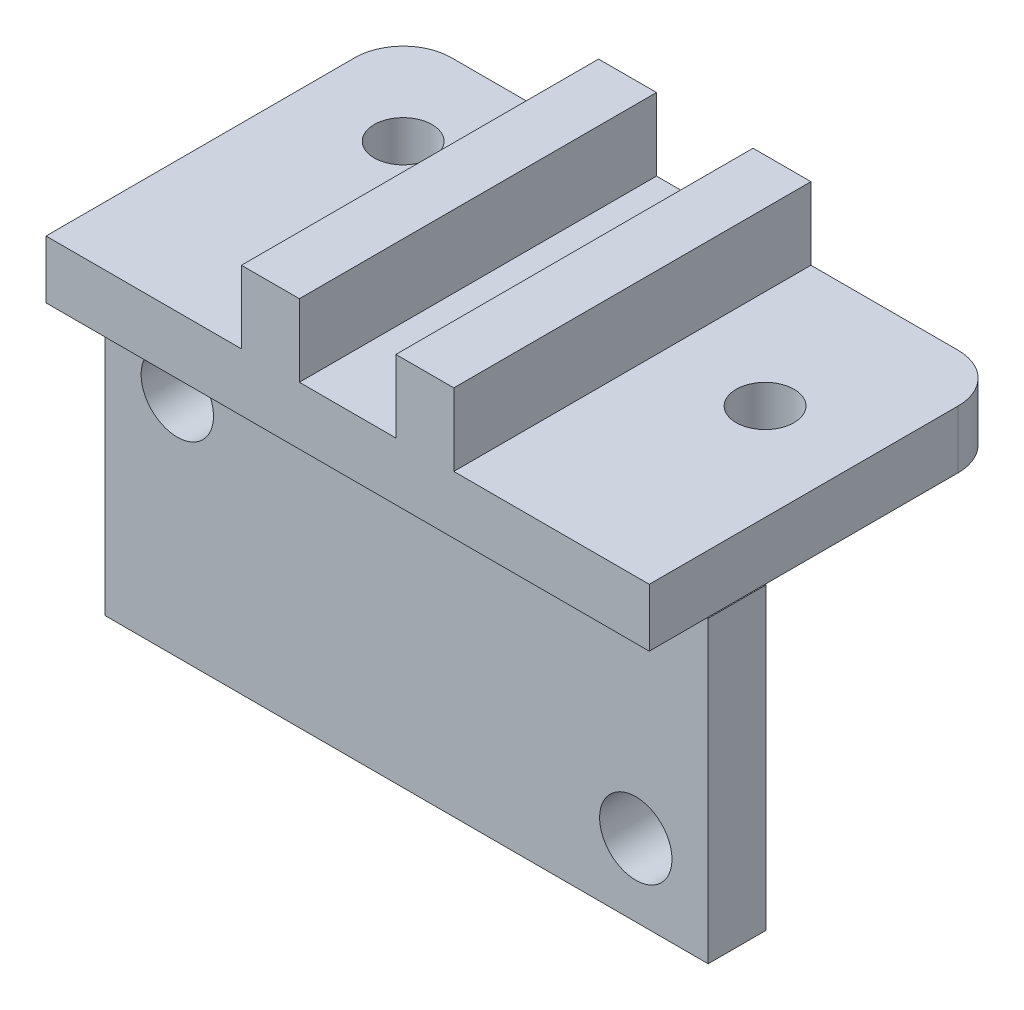
from build123d import *

# Parameters (mm, degrees)
SKETCH1_W           = 125
SKETCH1_H           = 62
BOSS_EXTRUDE1_DEPTH = 12
BOSS_EXTRUDE5_DEPTH = 12
SKETCH6_R           = 7.5
CUT_EXTRUDE2_DEPTH  = 68
SKETCH8_W           = 12
SKETCH8_H           = 74
BOSS_EXTRUDE6_DEPTH = 15
SKETCH10_W          = 12
SKETCH10_H          = 50
BOSS_EXTRUDE7_DEPTH = 62
CUT_EXTRUDE3_DEPTH  = 62
SKETCH12_R          = 6
CUT_EXTRUDE4_DEPTH  = 62


with BuildPart() as part:
    # Sketch1 → Boss-Extrude1 (new body)
    with BuildSketch(Plane.XY):
        with Locations((48.885172376, -31)):
            Rectangle(SKETCH1_W, SKETCH1_H)
    extrude(amount=BOSS_EXTRUDE1_DEPTH)

    # Sketch5 → Boss-Extrude5 (add)
    with BuildSketch(Plane(origin=(0, 0, 0), x_dir=(1, 0, 0), z_dir=(0, 1, 0))):
        with BuildLine():
            Line((-3.819103259, 50), (101.180896741, 50))
            ThreePointArc((101.180896741, 50), (108.251964553, 47.071067812), (111.180896741, 40))
            Line((111.180896741, 40), (111.180896741, -24))
            Line((111.180896741, -24), (-13.819103259, -24))
            Line((-13.819103259, -24), (-13.819103259, 40))
            ThreePointArc((-13.819103259, 40), (-10.890171071, 47.071067812), (-3.819103259, 50))
        make_face()
    extrude(amount=BOSS_EXTRUDE5_DEPTH)

    # Sketch6 → Cut-Extrude2 (cut)
    with BuildSketch(Plane(origin=(0, 0, 0), x_dir=(-1, 0, 0), z_dir=(0, 0, -1))):
        with Locations((-96.385172376, -47)):
            Circle(SKETCH6_R)
        with Locations((-1.385172376, -15)):
            Circle(SKETCH6_R)
    extrude(amount=-CUT_EXTRUDE2_DEPTH, mode=Mode.SUBTRACT)

    # Sketch8 → Boss-Extrude6 (add)
    with BuildSketch(Plane(origin=(0, 12, 0), x_dir=(1, 0, 0), z_dir=(0, 1, 0))):
        with Locations((32.680896741, 13)):
            Rectangle(SKETCH8_W, SKETCH8_H)
        with Locations((64.680896741, 13)):
            Rectangle(SKETCH8_W, SKETCH8_H)
    extrude(amount=BOSS_EXTRUDE6_DEPTH)

    # Sketch10 → Boss-Extrude7 (add)
    with BuildSketch(Plane.XZ):
        with Locations((47.546562927, -25)):
            Rectangle(SKETCH10_W, SKETCH10_H)
    extrude(amount=BOSS_EXTRUDE7_DEPTH)

    # Sketch11 → Cut-Extrude3 (cut)
    with BuildSketch(Plane.ZY.offset(-41.546562927)):
        Polygon((-35.79571669, 0), (0, -62), (-50, -62), (-50, 0), align=None)
    extrude(amount=-CUT_EXTRUDE3_DEPTH, mode=Mode.SUBTRACT)

    # Sketch12 → Cut-Extrude4 (cut)
    with BuildSketch(Plane.XZ):
        with Locations(Location((6.180896741, -30, 0), (0, 0, 270))):
            Circle(SKETCH12_R)
        with Locations(Location((91.180896741, -20, 0), (0, 0, 270))):
            Circle(SKETCH12_R)
    extrude(amount=-CUT_EXTRUDE4_DEPTH, mode=Mode.SUBTRACT)


solid = part.part
